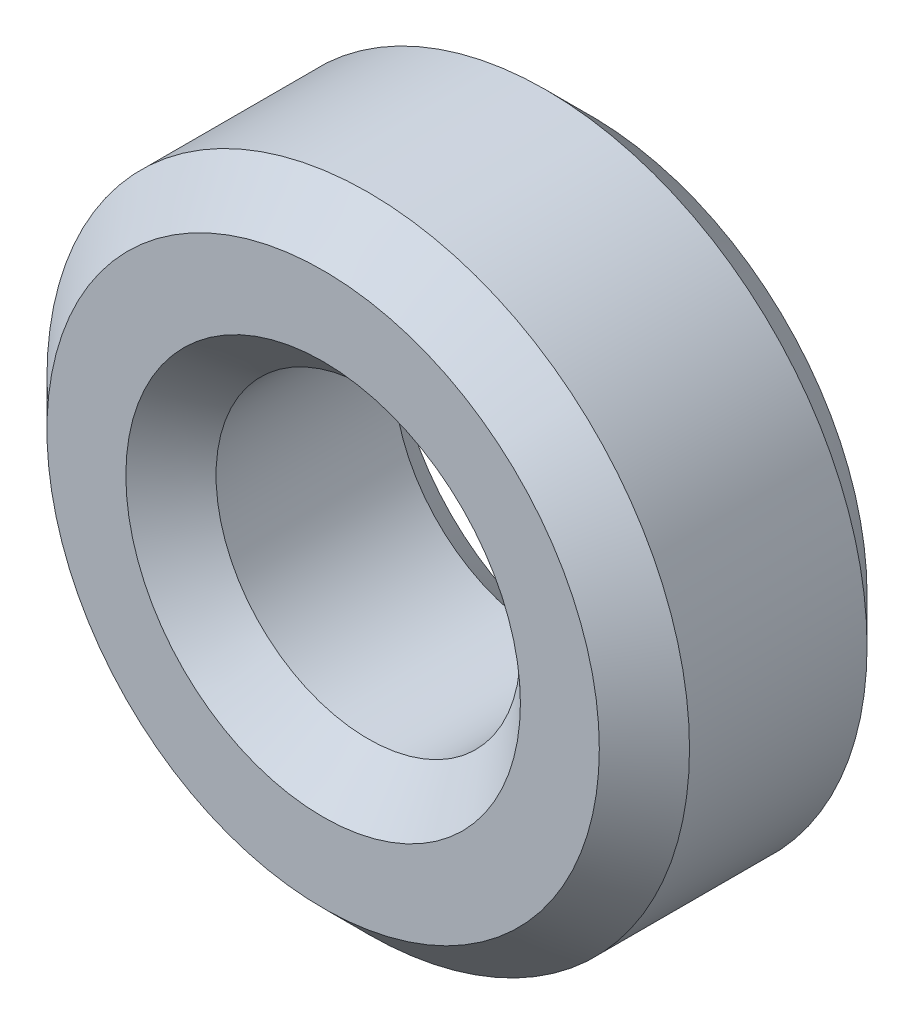
from build123d import *

# Parameters (mm, degrees)
ESBO_O1_R                = 5.7
ESBO_O1_R_2              = 2.7
RESSALTO_EXTRUS_O1_DEPTH = 4.75
CHANFRO1_SIZE            = 0.8


with BuildPart() as part:
    # Esboço1 → Ressalto-extrusão1 (new body)
    with BuildSketch(Plane.XY):
        Circle(ESBO_O1_R)
        Circle(ESBO_O1_R_2, mode=Mode.SUBTRACT)
    extrude(amount=RESSALTO_EXTRUS_O1_DEPTH)

    # Chanfro1
    chanfro1_edges = [part.edges().sort_by_distance(p)[0] for p in [
        (-5.7, 0, 0),
        (-5.7, 0, 4.75),
        (-2.7, 0, 0),
        (-2.7, 0, 4.75),
    ]]
    chamfer(chanfro1_edges, length=CHANFRO1_SIZE)


solid = part.part
